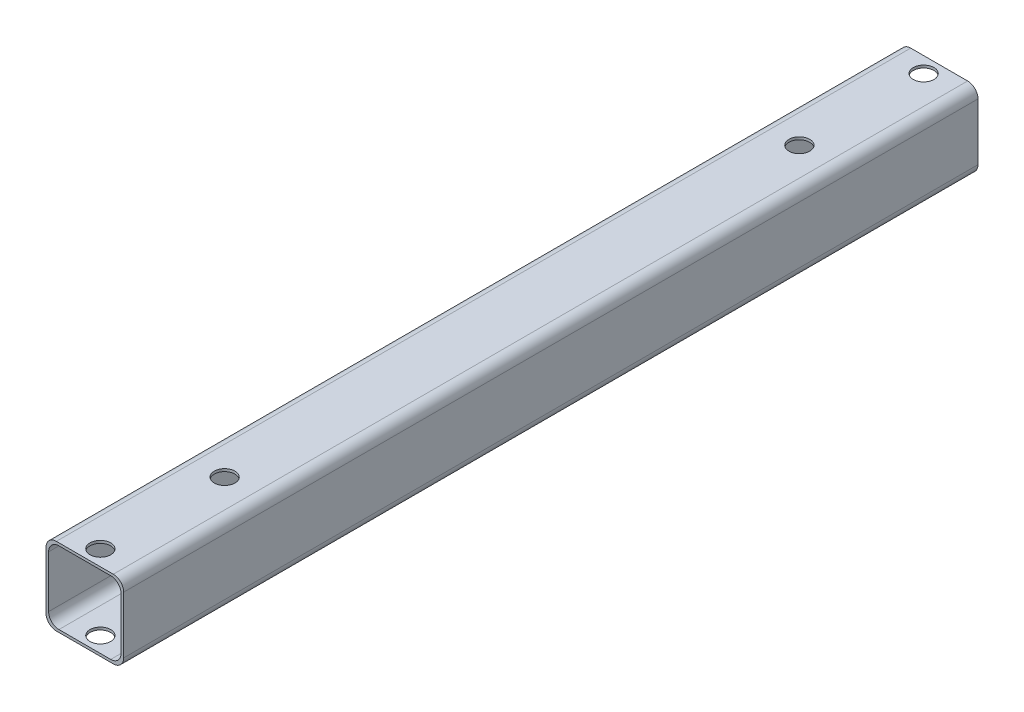
from build123d import *

# Parameters (mm, degrees)
SKETCH1_W           = 15
SKETCH1_H           = 15
SKETCH1_W_2         = 14
SKETCH1_H_2         = 14
BOSS_EXTRUDE1_DEPTH = 165
FILLET1_R           = 2
SKETCH2_R           = 2
CUT_EXTRUDE2_DEPTH  = 28


with BuildPart() as part:
    # Sketch1 → Boss-Extrude1 (new body)
    with BuildSketch(Plane.XY):
        Rectangle(SKETCH1_W, SKETCH1_H)
        Rectangle(SKETCH1_W_2, SKETCH1_H_2, mode=Mode.SUBTRACT)
    extrude(amount=BOSS_EXTRUDE1_DEPTH)

    # Fillet1
    fillet1_edges = [part.edges().sort_by_distance(p)[0] for p in [
        (-7, 7, 82.5),
        (-7, -7, 82.5),
        (7, -7, 82.5),
        (7, 7, 82.5),
        (-7.5, 7.5, 82.5),
        (7.5, 7.5, 82.5),
        (7.5, -7.5, 82.5),
        (-7.5, -7.5, 82.5),
    ]]
    fillet(fillet1_edges, radius=FILLET1_R)

    # Sketch2 → Cut-Extrude2 (cut)
    with BuildSketch(Plane.XZ.offset(7.5)):
        with Locations((0, 162)):
            Circle(SKETCH2_R)
        with Locations((0, 138)):
            Circle(SKETCH2_R)
        with Locations((0, 27)):
            Circle(SKETCH2_R)
        with Locations((0, 3)):
            Circle(SKETCH2_R)
    extrude(amount=-CUT_EXTRUDE2_DEPTH, mode=Mode.SUBTRACT)


solid = part.part
